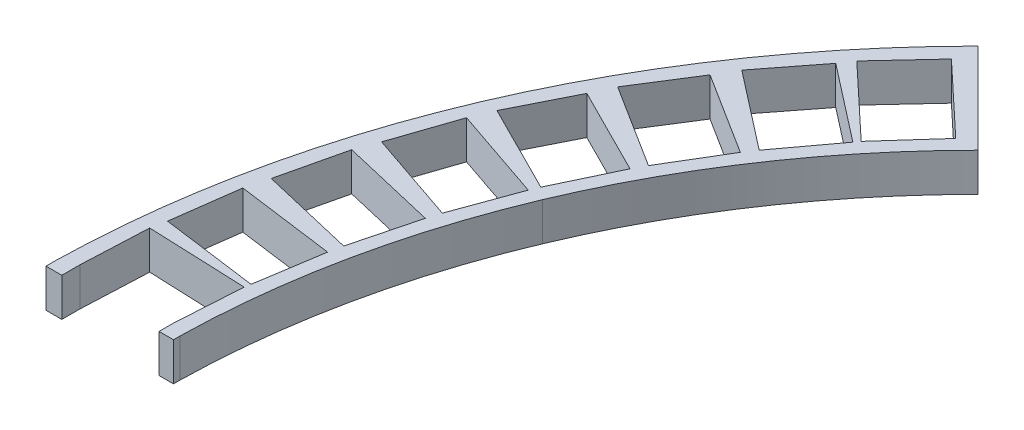
from build123d import *

# Parameters (mm, degrees)
BOSS_EXTRUDE1_DEPTH = 12


with BuildPart() as part:
    # Sketch1 → Boss-Extrude1 (new body)
    with BuildSketch(Plane(origin=(0, 0, 0), x_dir=(1, 0, 0), z_dir=(0, 1, 0))):
        with BuildLine():
            Line((-208.730747898, 208.730747898), (-180.446460839, 180.446460839))
            ThreePointArc((-180.446460839, 180.446460839), (-211.871169585, 142.237594702), (-235.332727793, 98.683202756))
            ThreePointArc((-235.332727793, 98.683202756), (-249.691614544, 52.678245772), (-255.14471115, 4.794037172))
            Line((-255.14471115, 4.794037172), (-255.14471115, 2.779626551))
            Line((-255.14471115, 2.779626551), (-259.672052343, 2.779626551))
            Line((-259.672052343, 2.779626551), (-259.672052343, 7.204875095))
            Line((-259.672052343, 7.204875095), (-258.35063673, 28.168690687))
            Line((-258.35063673, 28.168690687), (-289.227344139, 29.411556091))
            Line((-289.227344139, 29.411556091), (-290.170172115, 8.432501391))
            Line((-290.170172115, 8.432501391), (-290.170172115, 2.779626551))
            Line((-290.170172115, 2.779626551), (-295.127762341, 2.779626551))
            Line((-295.127762341, 2.779626551), (-295.127762341, 6.054265565))
            ThreePointArc((-295.127762341, 6.054265565), (-271.547028538, 115.755179272), (-208.730747898, 208.730747898))
        make_face()
        Polygon((-288.286547304, 34.069084362), (-258.033222279, 30.008925637), (-254.767009525, 50.758854735), (-285.491553173, 54.882253531), align=None, mode=Mode.SUBTRACT)
        Polygon((-283.612878523, 61.915838046), (-253.89939669, 54.933619681), (-248.631031599, 75.267631401), (-278.809043274, 82.359007245), align=None, mode=Mode.SUBTRACT)
        Polygon((-276.255921554, 89.176800074), (-247.361344598, 79.340855863), (-240.142390382, 99.066838813), (-269.488694715, 109.056554622), align=None, mode=Mode.SUBTRACT)
        Polygon((-229.967759139, 120.819849226), (-238.977493449, 101.844802692), (-266.671759318, 115.77418308), (-257.235727442, 134.534814797), align=None, mode=Mode.SUBTRACT)
        Polygon((-217.141868251, 142.590375773), (-227.952465343, 124.580414811), (-254.16244031, 141.134484167), (-242.948393328, 158.889628499), align=None, mode=Mode.SUBTRACT)
        Polygon((-202.261755682, 163.008777697), (-214.772333152, 146.135332444), (-239.248466479, 165.159498585), (-226.362501502, 181.741172494), align=None, mode=Mode.SUBTRACT)
        Polygon((-187.145427565, 180.161244264), (-201.171686006, 164.525011421), (-223.699930588, 185.676700973), (-209.397447264, 201.053587246), align=None, mode=Mode.SUBTRACT)
    extrude(amount=BOSS_EXTRUDE1_DEPTH)


solid = part.part
